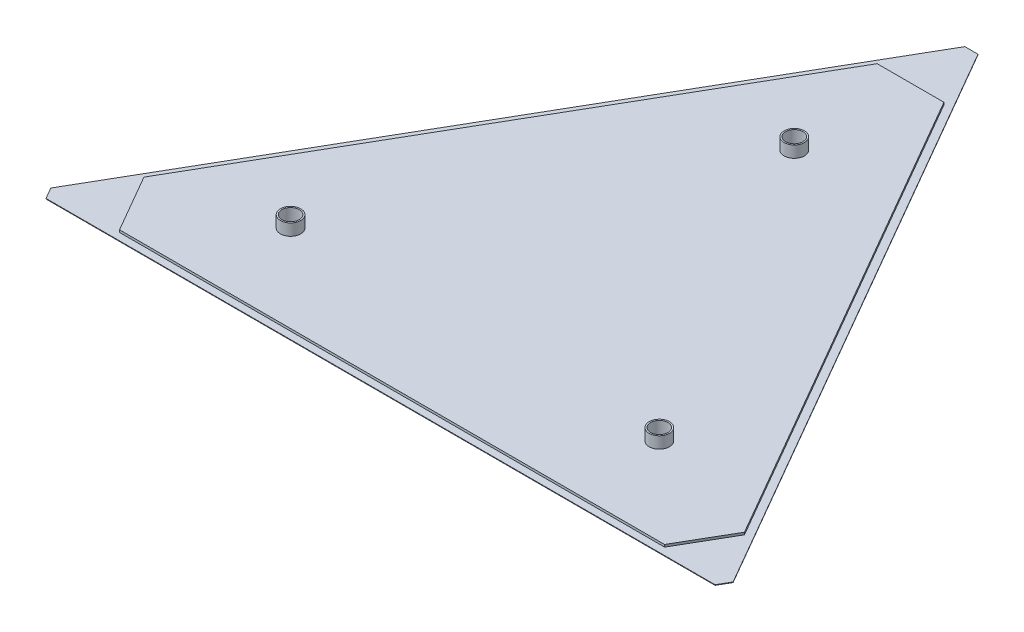
from build123d import *

# Parameters (mm, degrees)
SKETCH1_R             = 3
SKETCH1_R_2           = 1.5
BOSS_EXTRUDE1_DEPTH   = 0.2
BOSS_EXTRUDE1_2_DEPTH = 0.2
BOSS_EXTRUDE1_3_DEPTH = 0.2
BOSS_EXTRUDE1_4_DEPTH = 0.2
SKETCH1_14_R          = 3.5
BOSS_EXTRUDE2_DEPTH   = 1
SKETCH1_17_R          = 3.5
SKETCH1_17_R_2        = 3
BOSS_EXTRUDE4_DEPTH   = 5


with BuildPart() as part:
    # Sketch1 → Boss-Extrude1 (new body)
    with BuildSketch(Plane(origin=(0, 0, 0), x_dir=(1, 0, 0), z_dir=(0, 1, 0))):
        with Locations((347.273609729, 3.609230825)):
            Circle(SKETCH1_R)
        with Locations((347.273609729, 3.609230825)):
            Circle(SKETCH1_R_2, mode=Mode.SUBTRACT)
    extrude(amount=BOSS_EXTRUDE1_DEPTH)



with BuildPart() as body_2:
    # Sketch1 → Boss-Extrude1 2 (new body)
    with BuildSketch(Plane(origin=(0, 0, 0), x_dir=(1, 0, 0), z_dir=(0, 1, 0))):
        with Locations((410.793152563, -106.417182487)):
            Circle(SKETCH1_R)
        with Locations((410.793152563, -106.417182487)):
            Circle(SKETCH1_R_2, mode=Mode.SUBTRACT)
    extrude(amount=BOSS_EXTRUDE1_2_DEPTH)


with BuildPart() as body_3:
    # Sketch1 → Boss-Extrude1 3 (new body)
    with BuildSketch(Plane(origin=(0, 0, 0), x_dir=(1, 0, 0), z_dir=(0, 1, 0))):
        with Locations((283.758521159, -106.426112565)):
            Circle(SKETCH1_R)
        with Locations((283.758521159, -106.426112565)):
            Circle(SKETCH1_R_2, mode=Mode.SUBTRACT)
    extrude(amount=BOSS_EXTRUDE1_3_DEPTH)


with BuildPart() as body_4:
    # Sketch1 → Boss-Extrude1 4 (new body)
    with BuildSketch(Plane(origin=(0, 0, 0), x_dir=(1, 0, 0), z_dir=(0, 1, 0))):
        Polygon((231.981171214, -138.914415757), (229.712705007, -134.986323544), (344.980692969, 64.663360453), (349.516789508, 64.663360453), (464.784783451, -134.986661544), (462.517056767, -138.914415757), align=None)
        Polygon((243.304219773, -116.484791866), (254.809280576, -136.408896139), (442.602090749, -136.409305398), (452.699916625, -118.984688015), (358.778179035, 43.666038066), (335.767496284, 43.666038066), align=None, mode=Mode.SUBTRACT)
    extrude(amount=BOSS_EXTRUDE1_4_DEPTH)

    # Sketch1<14> → Boss-Extrude2 (add)
    with BuildSketch(Plane(origin=(0, 0, 0), x_dir=(1, 0, 0), z_dir=(0, 1, 0))):
        Polygon((335.767496284, 43.666038066), (243.304219773, -116.484791866), (254.809280576, -136.408896139), (442.602090749, -136.409305398), (452.699916625, -118.984688015), (358.778179035, 43.666038066), align=None)
        with Locations((283.758521159, -106.426112565)):
            Circle(SKETCH1_14_R, mode=Mode.SUBTRACT)
        with Locations((410.793152563, -106.417182487)):
            Circle(SKETCH1_14_R, mode=Mode.SUBTRACT)
        with Locations((347.273609729, 3.609230825)):
            Circle(SKETCH1_14_R, mode=Mode.SUBTRACT)
    extrude(amount=BOSS_EXTRUDE2_DEPTH)


with BuildPart() as part_1:
    add(part.part)

    add(body_2.part)  # Boss-Extrude4 merges body 2

    add(body_3.part)  # Boss-Extrude4 merges body 3

    add(body_4.part)  # Boss-Extrude4 merges body 4
    # Sketch1<17> → Boss-Extrude4 (add)
    # profile 1 of 3: a face of its own
    with BuildSketch(Plane(origin=(0, 0, 0), x_dir=(1, 0, 0), z_dir=(0, 1, 0))):
        with Locations((347.273609729, 3.609230825)):
            Circle(SKETCH1_17_R)
        with Locations((347.273609729, 3.609230825)):
            Circle(SKETCH1_17_R_2, mode=Mode.SUBTRACT)
    # profile 2 of 3: a face of its own
    with BuildSketch(Plane(origin=(0, 0, 0), x_dir=(1, 0, 0), z_dir=(0, 1, 0))):
        with Locations((410.793152563, -106.417182487)):
            Circle(SKETCH1_17_R)
        with Locations((410.793152563, -106.417182487)):
            Circle(SKETCH1_17_R_2, mode=Mode.SUBTRACT)
    # profile 3 of 3: a face of its own
    with BuildSketch(Plane(origin=(0, 0, 0), x_dir=(1, 0, 0), z_dir=(0, 1, 0))):
        with Locations((283.758521159, -106.426112565)):
            Circle(SKETCH1_17_R)
        with Locations((283.758521159, -106.426112565)):
            Circle(SKETCH1_17_R_2, mode=Mode.SUBTRACT)
    extrude(amount=BOSS_EXTRUDE4_DEPTH)


solid = part_1.part
